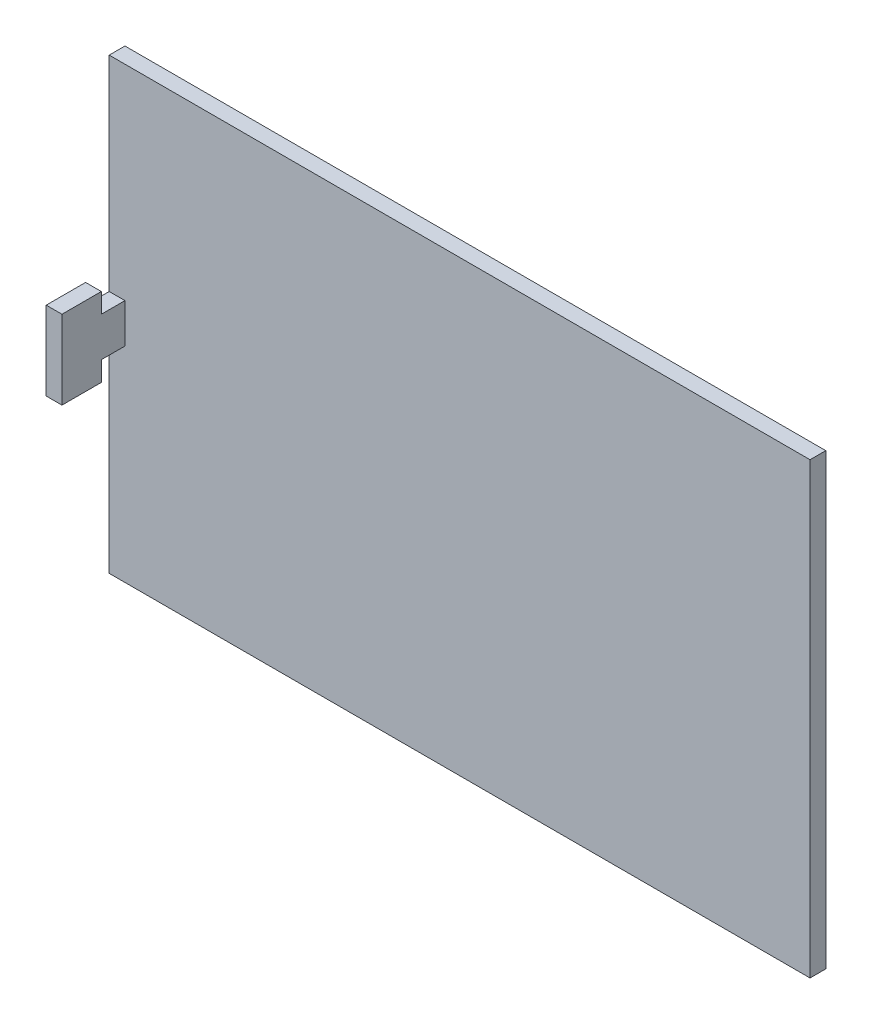
from build123d import *

# Parameters (mm, degrees)
ESQUISSE1_W        = 89
ESQUISSE1_H        = 57
BOSS_EXTRU_1_DEPTH = 2
ESQUISSE2_W        = 2
ESQUISSE2_H        = 5
BOSS_EXTRU_2_DEPTH = 3
ESQUISSE3_W        = 2
ESQUISSE3_H        = 10
BOSS_EXTRU_3_DEPTH = 5


with BuildPart() as part:
    # Esquisse1 → Boss.-Extru.1 (new body)
    with BuildSketch(Plane.XY):
        with Locations((-31.138342697, -4.162921348)):
            Rectangle(ESQUISSE1_W, ESQUISSE1_H)
    extrude(amount=BOSS_EXTRU_1_DEPTH)

    # Esquisse2 → Boss.-Extru.2 (add)
    with BuildSketch(Plane.XY.offset(2)):
        with Locations((-74.638342697, -4.162921348)):
            Rectangle(ESQUISSE2_W, ESQUISSE2_H)
    extrude(amount=BOSS_EXTRU_2_DEPTH)

    # Esquisse3 → Boss.-Extru.3 (add)
    with BuildSketch(Plane.XY.offset(5)):
        with Locations((-74.638342697, -4.162921348)):
            Rectangle(ESQUISSE3_W, ESQUISSE3_H)
    extrude(amount=BOSS_EXTRU_3_DEPTH)


solid = part.part
